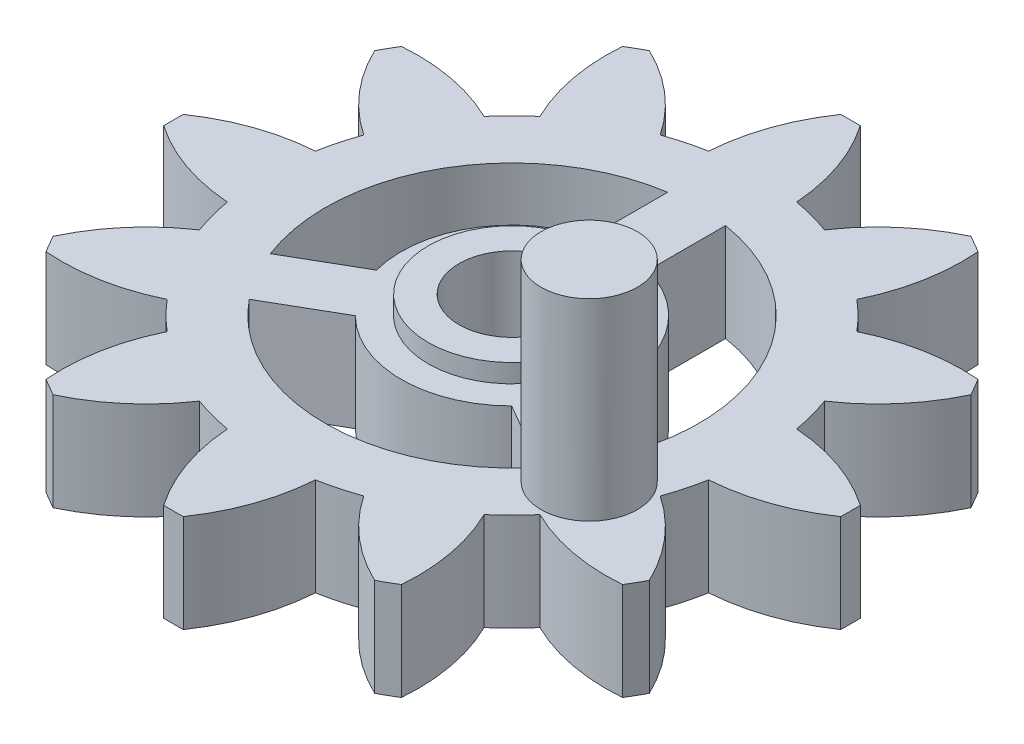
from build123d import *

# Parameters (mm, degrees)
BASE_PROFILE_R          = 12.7
GEAR_BASE_DEPTH         = 2.54
GEAR_START              = 2.54
GEAR_TOOTH_DEPTH        = 5.08
PATTERN_TOOTH_12T_COUNT = 12
LIP_PROFILE_R           = 4.348362351
LIP_DEPTH               = 3.5
SHAFT_START             = 0.96
HOLE_PROFILE_R          = 2.75
SHAFT_HOLE_DEPTH        = 7
GEAR_CUTOUT_DEPTH       = 5.08
HANDLE_PROFILE_R        = 2.5
HANDLE_DEPTH            = 10


with BuildPart() as part:
    # Base Profile → Gear Base (new, symmetric)
    with BuildSketch(Plane(origin=(0, 0, 0), x_dir=(1, 0, 0), z_dir=(0, 1, 0))):
        with Locations(Location((0, 0, 0), (0, 0, 270))):
            Circle(BASE_PROFILE_R)
    extrude(amount=GEAR_BASE_DEPTH, both=True)

    # Tooth Profile → Gear Tooth (add)
    with BuildSketch(Plane(origin=(0, 0, 0), x_dir=(1, 0, 0), z_dir=(0, 1, 0)).offset(GEAR_START)):
        with BuildLine():
            ThreePointArc((-2.286, 12.492565949), (-1.739501602, 15.15244151), (-0.508, 17.572565949))
            ThreePointArc((-0.508, 17.572565949), (0, 17.576799577), (0.508, 17.572565949))
            ThreePointArc((0.508, 17.572565949), (1.739501602, 15.15244151), (2.286, 12.492565949))
            ThreePointArc((2.286, 12.492565949), (0, 12.7), (-2.286, 12.492565949))
        make_face()
    gear_tooth = extrude(amount=-GEAR_TOOTH_DEPTH)

    # Pattern Tooth (12T): Gear Tooth ×12 about axis
    pattern_tooth_12t_axis = Axis((0, 0, 0), (0, 1, 0))
    for i in range(1, PATTERN_TOOTH_12T_COUNT):
        add(gear_tooth.rotate(pattern_tooth_12t_axis, i * 360 / PATTERN_TOOTH_12T_COUNT))

    # Lip Profile → Lip (add, symmetric)
    with BuildSketch(Plane(origin=(0, 0, 0), x_dir=(1, 0, 0), z_dir=(0, 1, 0))):
        with Locations(Location((0, 0, 0), (0, 0, 270))):
            Circle(LIP_PROFILE_R)
    extrude(amount=LIP_DEPTH, both=True)

    # Hole Profile → Shaft Hole (cut)
    with BuildSketch(Plane(origin=(0, 2.54, 0), x_dir=(1, 0, 0), z_dir=(0, 1, 0)).offset(SHAFT_START)):
        with Locations(Location((0, 0, 0), (0, 0, 270))):
            Circle(HOLE_PROFILE_R)
    extrude(amount=-SHAFT_HOLE_DEPTH, mode=Mode.SUBTRACT)

    # Cutout Profile → Gear Cutout (cut)
    with BuildSketch(Plane(origin=(0, 2.54, 0), x_dir=(1, 0, 0), z_dir=(0, 1, 0))):
        with BuildLine():
            Line((-1.5, 9.583318841), (-1.5, 5.550900828))
            ThreePointArc((-1.5, 5.550900828), (-4.979646072, 2.875), (-5.557221131, -1.476412308))
            Line((-5.557221131, -1.476412308), (-9.049397568, -3.492621315))
            ThreePointArc((-9.049397568, -3.492621315), (-8.400446417, 4.85), (-1.5, 9.583318841))
        make_face()
        with BuildLine():
            Line((1.5, 9.583318841), (1.5, 5.550900828))
            ThreePointArc((1.5, 5.550900828), (4.979646072, 2.875), (5.557221131, -1.476412308))
            Line((5.557221131, -1.476412308), (9.049397568, -3.492621315))
            ThreePointArc((9.049397568, -3.492621315), (8.400446417, 4.85), (1.5, 9.583318841))
        make_face()
        with BuildLine():
            Line((7.549397568, -6.090697526), (4.057221131, -4.07448852))
            ThreePointArc((4.057221131, -4.07448852), (0, -5.75), (-4.057221131, -4.07448852))
            Line((-4.057221131, -4.07448852), (-7.549397568, -6.090697526))
            ThreePointArc((-7.549397568, -6.090697526), (0, -9.7), (7.549397568, -6.090697526))
        make_face()
    extrude(amount=-GEAR_CUTOUT_DEPTH, mode=Mode.SUBTRACT)

    # Handle Profile → Handle (add)
    with BuildSketch(Plane(origin=(0, 2.54, 0), x_dir=(1, 0, 0), z_dir=(0, 1, 0))):
        with Locations(Location((9.483758311, -5.475450414, 0), (0, 0, 95.868617156))):
            Circle(HANDLE_PROFILE_R)
    extrude(amount=HANDLE_DEPTH)


solid = part.part
